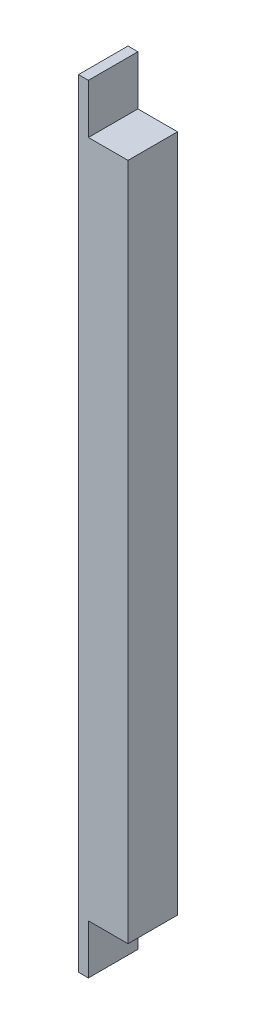
from build123d import *

# Parameters (mm, degrees)
ESQUISSE1_W             = 10
ESQUISSE1_H             = 10
BOSS_EXTRU_1_DEPTH      = 157
ESQUISSE2_W             = 10
ESQUISSE2_H             = 10
ENL_V_MAT_EXTRU_1_DEPTH = 8


with BuildPart() as part:
    # Esquisse1 → Boss.-Extru.1 (new body)
    with BuildSketch(Plane(origin=(0, 0, 0), x_dir=(1, 0, 0), z_dir=(0, 1, 0))):
        with Locations((5, 5)):
            Rectangle(ESQUISSE1_W, ESQUISSE1_H)
    extrude(amount=BOSS_EXTRU_1_DEPTH)

    # Esquisse2 → Enlèv. mat.-Extru.1 (cut)
    with BuildSketch(Plane(origin=(10, 0, 0), x_dir=(0, 0, -1), z_dir=(1, 0, 0))):
        with Locations((5, 152)):
            Rectangle(ESQUISSE2_W, ESQUISSE2_H)
        with Locations((5, 5)):
            Rectangle(ESQUISSE2_W, ESQUISSE2_H)
    extrude(amount=-ENL_V_MAT_EXTRU_1_DEPTH, mode=Mode.SUBTRACT)


solid = part.part
